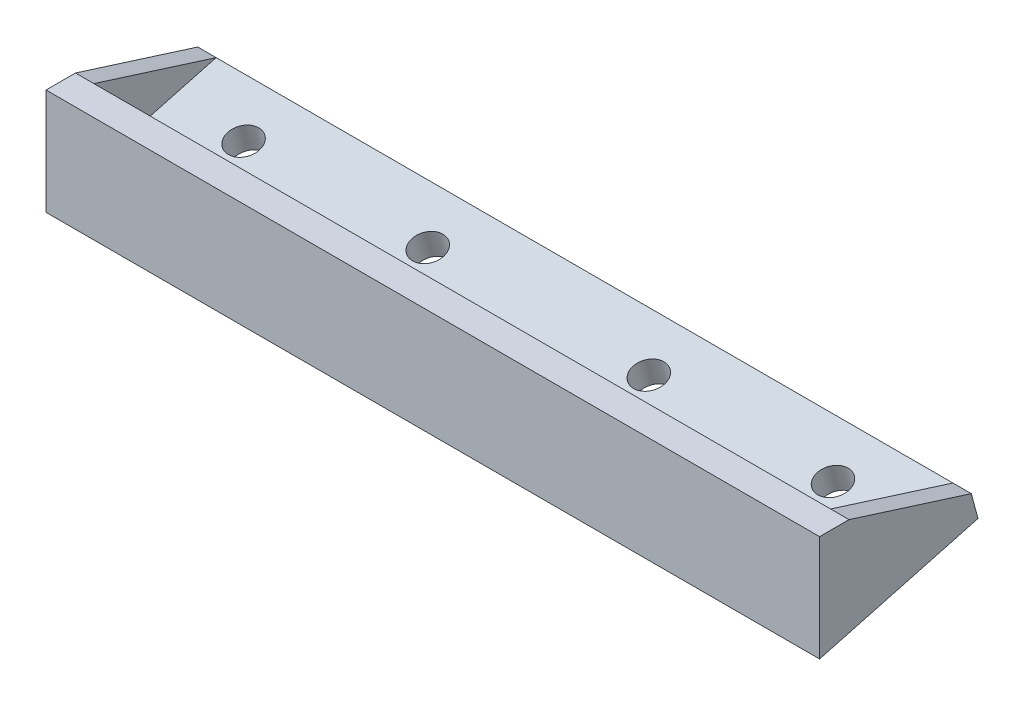
from build123d import *

# Parameters (mm, degrees)
EXTRUDE_1_DEPTH      = 30
SKETCH_2_R           = 44.45
CUT_EXTRUDE_1_DEPTH  = 4
SKETCH_3_R           = 25.5
SKETCH_3_R_2         = 2.25
CUT_EXTRUDE_2_DEPTH  = 188.619295383
CUT_EXTRUDE_3_DEPTH  = 189.215302247
SKETCH_5_R           = 1.65
CUT_EXTRUDE_4_DEPTH  = 189.215302247
EXTRUDE_START        = -30
EXTRUDE_2_DEPTH      = 30
CUT_EXTRUDE_5_DEPTH  = 198.040604952
CUT_EXTRUDE_7_DEPTH  = 233.432785983
CUT_EXTRUDE_8_DEPTH  = 233.432785983
CUT_EXTRUDE_9_DEPTH  = 233.432785983
FILLET_1_R           = 5
CUT_EXTRUDE_10_DEPTH = 233.432785983
EXTRUDE_START_2      = -5
EXTRUDE_3_DEPTH      = 5
EXTRUDE_4_DEPTH      = 5
SKETCH_14_R          = 4.25
CUT_EXTRUDE_11_DEPTH = 189.364728478
SKETCH_16_W          = 43
SKETCH_16_H          = 30
CUT_EXTRUDE_12_DEPTH = 233.432785983
EXTRUDE_7_REACH      = 188.592
SKETCH_18_W          = 210
SKETCH_18_H          = 5
EXTRUDE_8_DEPTH      = 210
EXTRUDE_9_DEPTH      = 5
EXTRUDE_10_DEPTH     = 5
SKETCH_22_R          = 4.25
CUT_EXTRUDE_13_DEPTH = 187.984035343
FILLET_2_R           = 5
CUT_EXTRUDE_14_DEPTH = 234.418610938


with BuildPart() as part:
    # 草图1 → 凸台-拉伸1 (new body)
    with BuildSketch(Plane(origin=(0, 0, 0), x_dir=(1, 0, 0), z_dir=(0, 1, 0))):
        with BuildLine():
            Line((170, 31.93), (170, -31.93))
            ThreePointArc((170, -31.93), (167.781993847, -38.210172909), (162.111885646, -41.704453387))
            Line((162.111885646, -41.704453387), (15.839142344, -73.308400404))
            ThreePointArc((15.839142344, -73.308400404), (-75, 0), (15.839142344, 73.308400404))
            Line((15.839142344, 73.308400404), (162.111885646, 41.704453387))
            ThreePointArc((162.111885646, 41.704453387), (167.781993847, 38.210172909), (170, 31.93))
        make_face()
    extrude(amount=EXTRUDE_1_DEPTH)

    # 草图2 → 切除-拉伸1 (cut)
    with BuildSketch(Plane(origin=(0, 30, 0), x_dir=(1, 0, 0), z_dir=(0, 1, 0))):
        with Locations(Location((0, 0, 0), (0, 0, 270))):
            Circle(SKETCH_2_R)
    extrude(amount=-CUT_EXTRUDE_1_DEPTH, mode=Mode.SUBTRACT)

    # 草图3 → 切除-拉伸2 (cut, through all)
    with BuildSketch(Plane(origin=(0, 26, 0), x_dir=(1, 0, 0), z_dir=(0, 1, 0))):
        with Locations(Location((0, 0, 0), (0, 0, 270))):
            Circle(SKETCH_3_R)
        with Locations(Location((0, 41, 0), (0, 0, 270))):
            Circle(SKETCH_3_R_2)
        with Locations(Location((28.991378029, 28.991378029, 0), (0, 0, 270))):
            Circle(SKETCH_3_R_2)
        with Locations(Location((41, 0, 0), (0, 0, 270))):
            Circle(SKETCH_3_R_2)
        with Locations(Location((28.991378029, -28.991378029, 0), (0, 0, 270))):
            Circle(SKETCH_3_R_2)
        with Locations(Location((0, -41, 0), (0, 0, 270))):
            Circle(SKETCH_3_R_2)
        with Locations(Location((-28.991378029, -28.991378029, 0), (0, 0, 270))):
            Circle(SKETCH_3_R_2)
        with Locations(Location((-41, 0, 0), (0, 0, 270))):
            Circle(SKETCH_3_R_2)
        with Locations(Location((-28.991378029, 28.991378029, 0), (0, 0, 270))):
            Circle(SKETCH_3_R_2)
    extrude(amount=-CUT_EXTRUDE_2_DEPTH, mode=Mode.SUBTRACT)

    # 草图4 → 切除-拉伸3 (cut, through all)
    with BuildSketch(Plane(origin=(0, 30, 0), x_dir=(1, 0, 0), z_dir=(0, 1, 0))):
        with BuildLine():
            Line((124, 18.5), (134, 18.5))
            ThreePointArc((134, 18.5), (152.5, 0), (134, -18.5))
            Line((134, -18.5), (124, -18.5))
            ThreePointArc((124, -18.5), (105.5, 0), (124, 18.5))
        make_face()
    extrude(amount=-CUT_EXTRUDE_3_DEPTH, mode=Mode.SUBTRACT)

    # 草图5 → 切除-拉伸4 (cut, through all)
    with BuildSketch(Plane(origin=(0, 30, 0), x_dir=(1, 0, 0), z_dir=(0, 1, 0))):
        with Locations(Location((116.75, 25.5, 0), (0, 0, 270))):
            Circle(SKETCH_5_R)
        with Locations(Location((141.25, 25.5, 0), (0, 0, 270))):
            Circle(SKETCH_5_R)
        with Locations(Location((141.25, -25.5, 0), (0, 0, 270))):
            Circle(SKETCH_5_R)
        with Locations(Location((116.75, -25.5, 0), (0, 0, 270))):
            Circle(SKETCH_5_R)
    extrude(amount=-CUT_EXTRUDE_4_DEPTH, mode=Mode.SUBTRACT)

    # 草图6 → 凸台-拉伸2 (add)
    with BuildSketch(Plane(origin=(0, 30, 0), x_dir=(1, 0, 0), z_dir=(0, 1, 0)).offset(EXTRUDE_START)):
        with BuildLine():
            Line((158, 95), (-52, 95))
            Line((-52, 95), (-52, 54.046276467))
            ThreePointArc((-52, 54.046276467), (-20.48558667, 72.148047366), (15.839142344, 73.308400404))
            Line((15.839142344, 73.308400404), (158, 42.592874655))
            Line((158, 42.592874655), (158, 95))
        make_face()
        with BuildLine():
            ThreePointArc((15.839142344, -73.308400404), (-20.48558667, -72.148047366), (-52, -54.046276467))
            Line((-52, -54.046276467), (-52, -95))
            Line((-52, -95), (158, -95))
            Line((158, -95), (158, -42.592874655))
            Line((158, -42.592874655), (15.839142344, -73.308400404))
        make_face()
    extrude(amount=EXTRUDE_2_DEPTH)

    # 草图7 → 切除-拉伸5 (cut, through all)
    with BuildSketch(Plane(origin=(0, 30, 0), x_dir=(1, 0, 0), z_dir=(0, 1, 0))):
        with BuildLine():
            Line((-52, 54.046276467), (-52, -54.046276467))
            ThreePointArc((-52, -54.046276467), (-75, 0), (-52, 54.046276467))
        make_face()
        with BuildLine():
            Line((158, 42.592874655), (158, -42.592874655))
            Line((158, -42.592874655), (162.111885646, -41.704453387))
            ThreePointArc((162.111885646, -41.704453387), (167.781993847, -38.210172909), (170, -31.93))
            Line((170, -31.93), (170, 31.93))
            ThreePointArc((170, 31.93), (167.781993847, 38.210172909), (162.111885646, 41.704453387))
            Line((162.111885646, 41.704453387), (158, 42.592874655))
        make_face()
    extrude(amount=-CUT_EXTRUDE_5_DEPTH, mode=Mode.SUBTRACT)

    # 草图9 → 切除-拉伸7 (cut, through all)
    with BuildSketch(Plane.ZY.offset(52)):
        Polygon((-95, 20), (-60, 10.621778265), (-60, 30), (-95, 30), align=None)
    extrude(amount=-CUT_EXTRUDE_7_DEPTH, mode=Mode.SUBTRACT)

    # 草图10 → 切除-拉伸8 (cut, through all)
    with BuildSketch(Plane.ZY.offset(52)):
        Polygon((-95, 12.753066737), (-52, 1.231251463), (-52, 0), (-95, 0), align=None)
    extrude(amount=-CUT_EXTRUDE_8_DEPTH, mode=Mode.SUBTRACT)

    # 草图8 → 切除-拉伸9 (cut, through all)
    with BuildSketch(Plane.ZY.offset(52)):
        Polygon((0, 0), (52, 0), (52, 17.3), (-52, 17.3), (-52, 0), align=None)
    extrude(amount=-CUT_EXTRUDE_9_DEPTH, mode=Mode.SUBTRACT)

    # 圆角1
    fillet_1_edges = [part.edges().sort_by_distance(p)[0] for p in [
        (53, 10.621778265, -60),
    ]]
    fillet(fillet_1_edges, radius=FILLET_1_R)

    # 草图11 → 切除-拉伸10 (cut, through all)
    with BuildSketch(Plane.ZY.offset(52)):
        Polygon((-95, 12.753066737), (-93.188266684, 19.514547521), (-95, 20), align=None)
    extrude(amount=-CUT_EXTRUDE_10_DEPTH, mode=Mode.SUBTRACT)

    # 草图12 → 凸台-拉伸3 (add)
    with BuildSketch(Plane.ZY.offset(52).offset(EXTRUDE_START_2)):
        with BuildLine():
            Line((-93.188266684, 19.514547521), (-60, 30))
            Line((-60, 30), (-60, 17.137905129))
            ThreePointArc((-60, 17.137905129), (-61.956192855, 13.171138428), (-66.294095226, 12.308275998))
            Line((-66.294095226, 12.308275998), (-93.188266684, 19.514547521))
        make_face()
    extrude(amount=EXTRUDE_3_DEPTH)

    # 草图13 → 凸台-拉伸4 (add)
    with BuildSketch(Plane(origin=(158, 0, 0), x_dir=(0, 0, -1), z_dir=(1, 0, 0))):
        with BuildLine():
            Line((66.294095226, 12.308275998), (93.188266684, 19.514547521))
            Line((93.188266684, 19.514547521), (60, 30))
            Line((60, 30), (60, 17.137905129))
            ThreePointArc((60, 17.137905129), (61.956192855, 13.171138428), (66.294095226, 12.308275998))
        make_face()
    extrude(amount=-EXTRUDE_4_DEPTH)

    # 草图14 → 切除-拉伸11 (cut, through all)
    with BuildSketch(Plane(origin=(0, -5.089745962, -1.36379332), x_dir=(1, 0, 0), z_dir=(0, 0.9659258262890681, 0.2588190451025214))):
        with Locations(Location((-27, 82.063690052, 0), (0, 0, 270))):
            Circle(SKETCH_14_R)
        with Locations(Location((23, 82.063690052, 0), (0, 0, 270))):
            Circle(SKETCH_14_R)
        with Locations(Location((83, 82.063690052, 0), (0, 0, 270))):
            Circle(SKETCH_14_R)
        with Locations(Location((133, 82.063690052, 0), (0, 0, 270))):
            Circle(SKETCH_14_R)
    extrude(amount=-CUT_EXTRUDE_11_DEPTH, mode=Mode.SUBTRACT)

    # 草图16 → 切除-拉伸12 (cut, through all)
    with BuildSketch(Plane.ZY.offset(52)):
        with Locations((73.5, 15)):
            Rectangle(SKETCH_16_W, SKETCH_16_H)
    extrude(amount=-CUT_EXTRUDE_12_DEPTH, mode=Mode.SUBTRACT)

    # 凸台-拉伸7: up to this plane
    extrude_7_end = Plane(origin=(0, -11.851226746, -3.175526636), z_dir=(0, -0.9659258262890681, -0.25881904510252146))
    # 草图18 → 凸台-拉伸7 (add, up to the surface)
    with BuildSketch(Plane(origin=(0, 30, 0), x_dir=(1, 0, 0), z_dir=(0, 1, 0)), mode=Mode.PRIVATE) as extrude_7_sk1:
        with Locations((53, -54.5)):
            Rectangle(SKETCH_18_W, SKETCH_18_H)
    extrude_7_tool1 = split(extrude(extrude_7_sk1.sketch, amount=-EXTRUDE_7_REACH, mode=Mode.PRIVATE), bisect_by=extrude_7_end, keep=Keep.BOTH, mode=Mode.PRIVATE)
    add(extrude_7_tool1.solids().sort_by_distance((53, 30, 54.5))[0])

    # 草图19 → 凸台-拉伸8 (add)
    with BuildSketch(Plane.ZY.offset(52)):
        Polygon((57, -27.975210512), (90.188266684, -36.867979769), (92, -30.106498985), (57, -20.72827725), align=None)
    extrude(amount=-EXTRUDE_8_DEPTH)

    # 草图20 → 凸台-拉伸9 (add)
    with BuildSketch(Plane.ZY.offset(52)):
        Polygon((92, -30.106498985), (57, -20.72827725), (57, 30), align=None)
    extrude(amount=-EXTRUDE_9_DEPTH)

    # 草图21 → 凸台-拉伸10 (add)
    with BuildSketch(Plane(origin=(158, 0, 0), x_dir=(0, 0, -1), z_dir=(1, 0, 0))):
        Polygon((-57, 30), (-92, -30.106498985), (-57, -20.72827725), align=None)
    extrude(amount=-EXTRUDE_10_DEPTH)

    # 草图22 → 切除-拉伸13 (cut, through all)
    with BuildSketch(Plane(origin=(0, -5.089745962, -1.36379332), x_dir=(1, 0, 0), z_dir=(0, 0.9659258262890686, 0.25881904510251946))):
        with Locations(Location((-27, -77.936309948, 0), (0, 0, 270))):
            Circle(SKETCH_22_R)
        with Locations(Location((23, -69.936309948, 0), (0, 0, 270))):
            Circle(SKETCH_22_R)
        with Locations(Location((83, -69.936309948, 0), (0, 0, 270))):
            Circle(SKETCH_22_R)
        with Locations(Location((133, -77.936309948, 0), (0, 0, 270))):
            Circle(SKETCH_22_R)
    extrude(amount=-CUT_EXTRUDE_13_DEPTH, mode=Mode.SUBTRACT)

    # 圆角2
    fillet_2_edges = [part.edges().sort_by_distance(p)[0] for p in [
        (53, -20.72827725, 57),
    ]]
    fillet(fillet_2_edges, radius=FILLET_2_R)

    # 草图23 → 切除-拉伸14 (cut, through all)
    with BuildSketch(Plane.ZY.offset(52)):
        Polygon((-52, 17.3), (-52, 40.52409207), (98.672945053, 40.52409207), (98.672945053, -43.91232927), (-52, -43.91232927), align=None)
    extrude(amount=-CUT_EXTRUDE_14_DEPTH, mode=Mode.SUBTRACT)


solid = part.part
